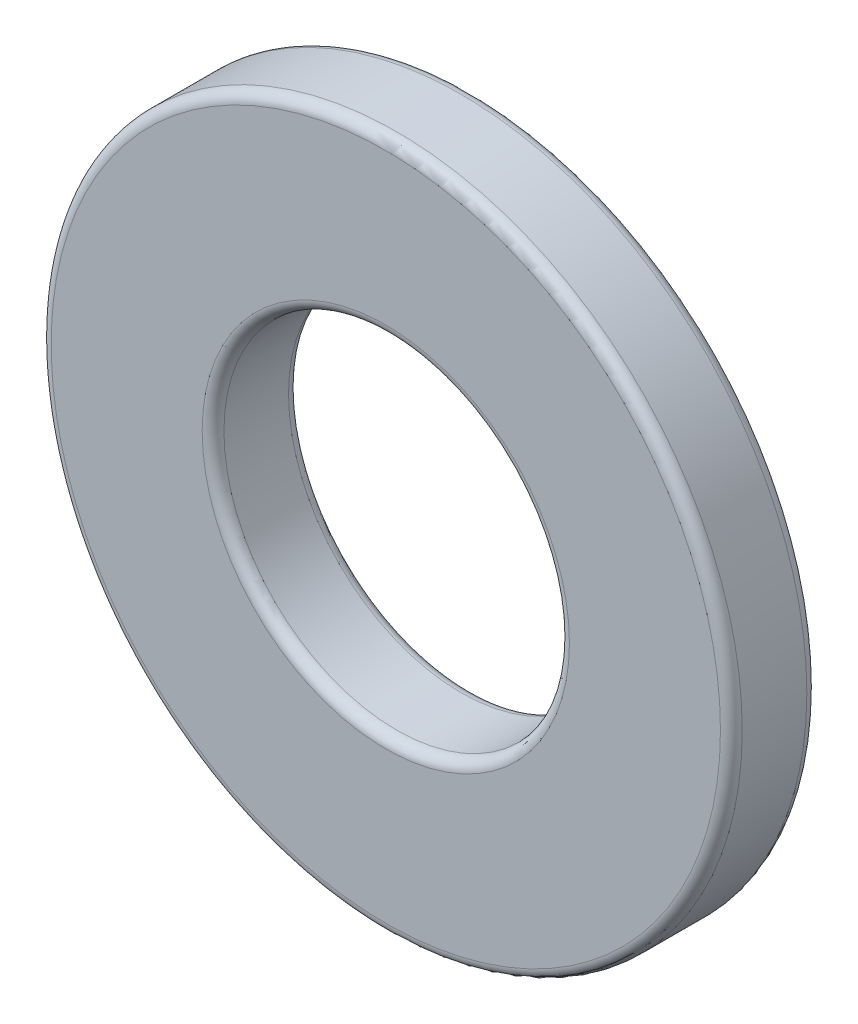
from build123d import *

# Parameters (mm, degrees)
SKETCH1_R           = 6.35
BOSS_EXTRUDE1_DEPTH = 1.5875
SKETCH2_R           = 3.175
CUT_EXTRUDE1_DEPTH  = 76.374385622
FILLET1_R           = 0.2


with BuildPart() as part:
    # Sketch1 → Boss-Extrude1 (new body)
    with BuildSketch(Plane.XY):
        with Locations((68.398246491, 3.214386977)):
            Circle(SKETCH1_R)
    extrude(amount=BOSS_EXTRUDE1_DEPTH)

    # Sketch2 → Cut-Extrude1 (cut, through all)
    with BuildSketch(Plane(origin=(0, 0, 0), x_dir=(-1, 0, 0), z_dir=(0, 0, -1))):
        with Locations((-68.398246491, 3.214386977)):
            Circle(SKETCH2_R)
    extrude(amount=-CUT_EXTRUDE1_DEPTH, mode=Mode.SUBTRACT)

    # Fillet1
    fillet1_edges = [part.edges().sort_by_distance(p)[0] for p in [
        (62.048246491, 3.214386977, 0),
        (62.048246491, 3.214386977, 1.5875),
        (71.573246491, 3.214386977, 1.5875),
        (71.573246491, 3.214386977, 0),
    ]]
    fillet(fillet1_edges, radius=FILLET1_R)


solid = part.part
